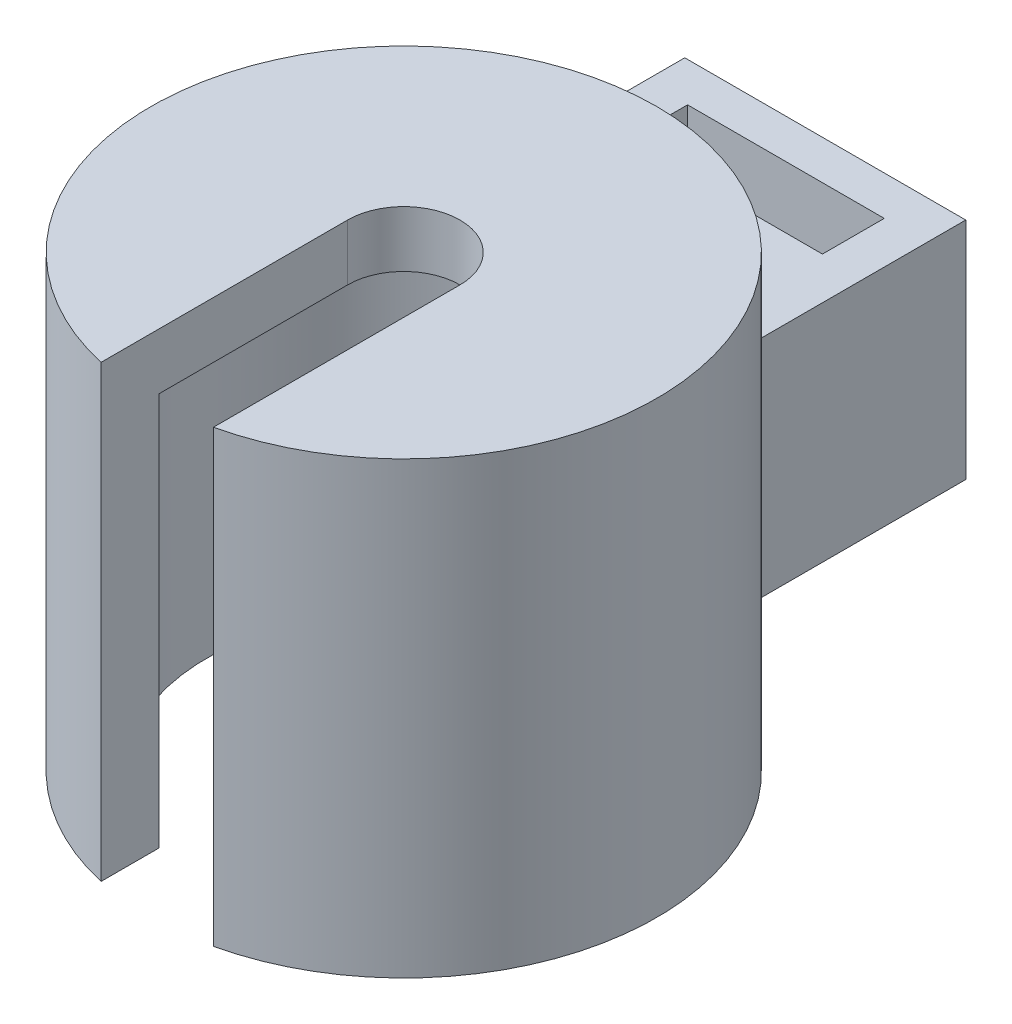
from build123d import *

# Parameters (mm, degrees)
BOSS_EXTRUDE1_DEPTH      = 7
BOSS_EXTRUDE2_DEPTH      = 1
BOSS_EXTRUDE3_DEPTH      = 2.5
BOSS_EXTRUDE3_DEPTH_BACK = 2.5
CUT_EXTRUDE1_DEPTH       = 7


with BuildPart() as part:
    # Sketch1 → Boss-Extrude1 (new body)
    with BuildSketch(Plane(origin=(0, 0, 0), x_dir=(1, 0, 0), z_dir=(0, 1, 0))):
        with BuildLine():
            Line((-1, -4.387482194), (-1, -3.354101966))
            ThreePointArc((-1, -3.354101966), (-2.091650066, 2.80624304), (3.5, 0))
            ThreePointArc((3.5, 0), (2.80624304, -2.091650066), (1, -3.354101966))
            Line((1, -3.354101966), (1, -4.387482194))
            ThreePointArc((1, -4.387482194), (3.51781182, -2.80624304), (4.5, 0))
            ThreePointArc((4.5, 0), (-2.80624304, 3.51781182), (-1, -4.387482194))
        make_face()
    extrude(amount=BOSS_EXTRUDE1_DEPTH)

    # Sketch2 → Boss-Extrude2 (add)
    with BuildSketch(Plane(origin=(0, 7, 0), x_dir=(1, 0, 0), z_dir=(0, 1, 0))):
        with BuildLine():
            Line((-1, -3.354101966), (-1, 0))
            ThreePointArc((-1, 0), (0, 1), (1, 0))
            Line((1, 0), (1, -3.354101966))
            ThreePointArc((1, -3.354101966), (0, 3.5), (-1, -3.354101966))
        make_face()
        with BuildLine():
            ThreePointArc((-1, -3.354101966), (0, 3.5), (1, -3.354101966))
            Line((1, -3.354101966), (1, -4.387482194))
            ThreePointArc((1, -4.387482194), (0, 4.5), (-1, -4.387482194))
            Line((-1, -4.387482194), (-1, -3.354101966))
        make_face()
    extrude(amount=BOSS_EXTRUDE2_DEPTH)

    # Sketch3 → Boss-Extrude3 (add, two sides: drawn at the far end of the back side and taken through both)
    with BuildSketch(Plane(origin=(0, 0, 0), x_dir=(0, 0, -1), z_dir=(1, 0, 0)).offset(-BOSS_EXTRUDE3_DEPTH_BACK)):
        Polygon((7.5, 6), (4.5, 6), (3.5, 6), (3.5, 2), (7.5, 2), align=None)
    extrude(amount=BOSS_EXTRUDE3_DEPTH + BOSS_EXTRUDE3_DEPTH_BACK)

    # Sketch4 → Cut-Extrude1 (cut)
    with BuildSketch(Plane(origin=(0, 6, 0), x_dir=(1, 0, 0), z_dir=(0, 1, 0))):
        Polygon((1.75, 6.8), (0, 6.8), (-1.75, 6.8), (-1.75, 5.7), (1.75, 5.7), align=None)
    extrude(amount=-CUT_EXTRUDE1_DEPTH, mode=Mode.SUBTRACT)


solid = part.part
